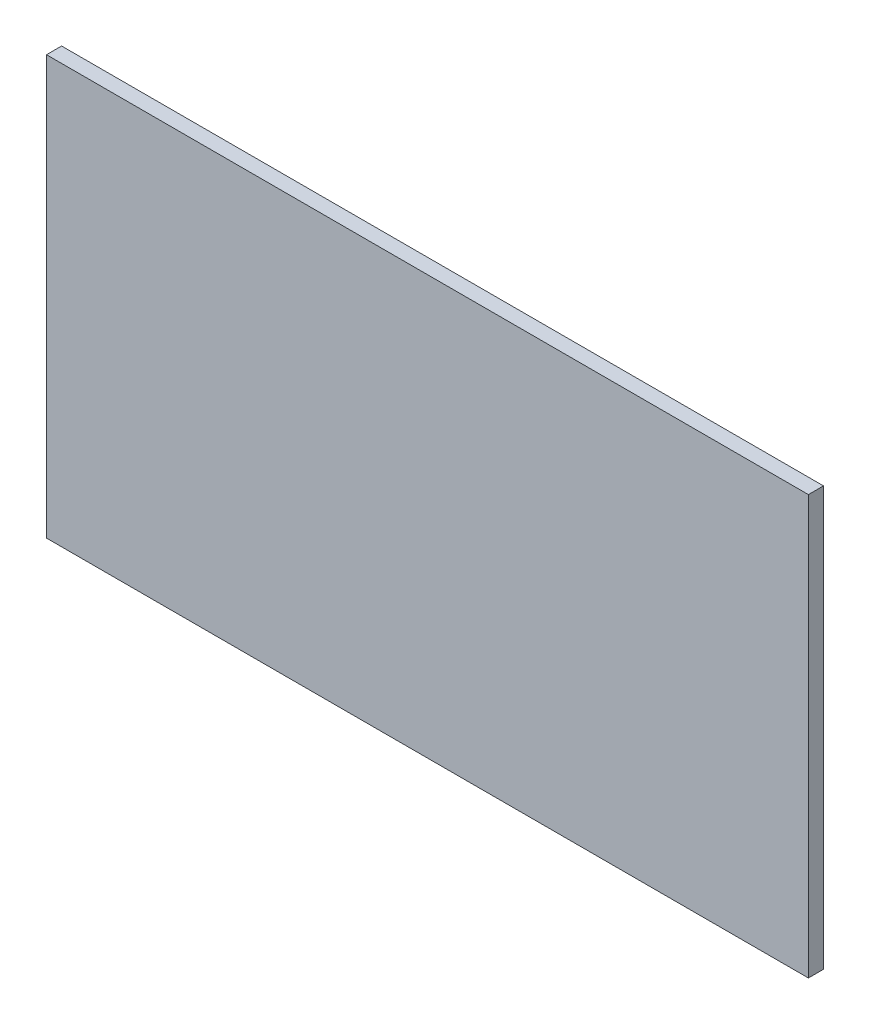
from build123d import *

# Parameters (mm, degrees)
ESBO_O1_W                = 20.2
ESBO_O1_H                = 11.1
RESSALTO_EXTRUS_O1_DEPTH = 0.4


with BuildPart() as part:
    # Esboço1 → Ressalto-extrusão1 (new body)
    with BuildSketch(Plane.XY):
        with Locations((10.1, 5.55)):
            Rectangle(ESBO_O1_W, ESBO_O1_H)
    extrude(amount=RESSALTO_EXTRUS_O1_DEPTH)


solid = part.part
